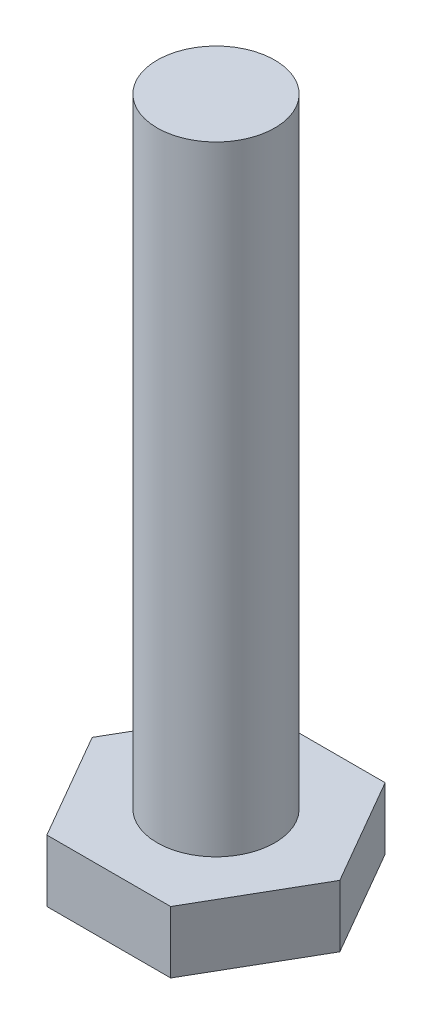
from build123d import *

# Parameters (mm, degrees)
SKETCH1_R           = 4.75
BOSS_EXTRUDE1_DEPTH = 5
SKETCH1_2_R         = 4.75
BOSS_EXTRUDE2_DEPTH = 55


with BuildPart() as part:
    # Sketch1 → Boss-Extrude1 (new body)
    with BuildSketch(Plane(origin=(0, 0, 0), x_dir=(1, 0, 0), z_dir=(0, 1, 0))):
        Polygon((10, 0), (5, 8.660254038), (-5, 8.660254038), (-10, 0), (-5, -8.660254038), (5, -8.660254038), align=None)
        Circle(SKETCH1_R, mode=Mode.SUBTRACT)
    extrude(amount=BOSS_EXTRUDE1_DEPTH)

    # Sketch1<2> → Boss-Extrude2 (add)
    with BuildSketch(Plane(origin=(0, 0, 0), x_dir=(1, 0, 0), z_dir=(0, 1, 0))):
        Circle(SKETCH1_2_R)
    extrude(amount=BOSS_EXTRUDE2_DEPTH)


solid = part.part
